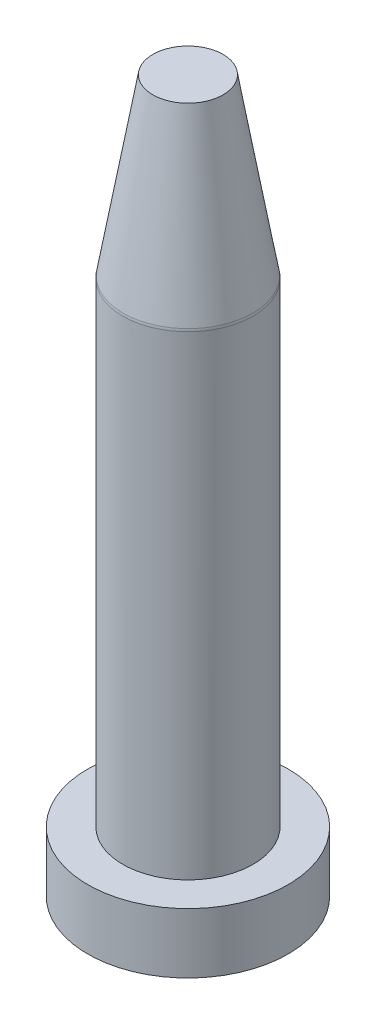
from build123d import *

# Parameters (mm, degrees)
FILLET_1_R = 3


with BuildPart() as part:
    # 草图1 → Revolve 295 (revolve)
    with BuildSketch(Plane.XY, mode=Mode.PRIVATE) as revolve_295_sk:
        Polygon((0, 0), (20, 0), (20, 12), (13, 12), (13, 107), (7, 142), (0, 142), align=None)
    revolve(revolve_295_sk.sketch.rotate(Axis((0, 0, 0), (0, 1, 0)), 90), axis=Axis((0, 0, 0), (0, 1, 0)))

    # 圆角1
    fillet_1_edges = [part.edges().sort_by_distance(p)[0] for p in [
        (0, 107, 13),
    ]]
    fillet(fillet_1_edges, radius=FILLET_1_R)


solid = part.part
